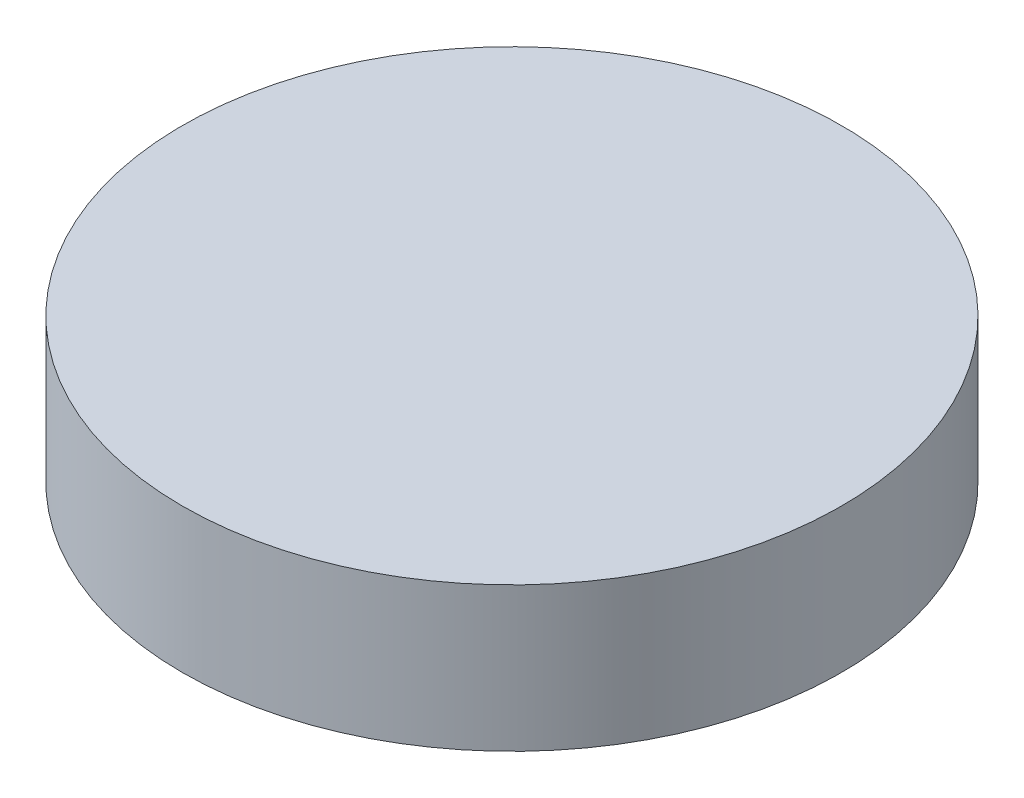
from build123d import *

# Parameters (mm, degrees)
SKETCH1_R           = 50.8
BOSS_EXTRUDE1_DEPTH = 22.225


with BuildPart() as part:
    # Sketch1 → Boss-Extrude1 (new body)
    with BuildSketch(Plane(origin=(0, 0, 0), x_dir=(1, 0, 0), z_dir=(0, 1, 0))):
        with Locations(Location((0, 0, 0), (0, 0, 270))):
            Circle(SKETCH1_R)
    extrude(amount=BOSS_EXTRUDE1_DEPTH)


solid = part.part
